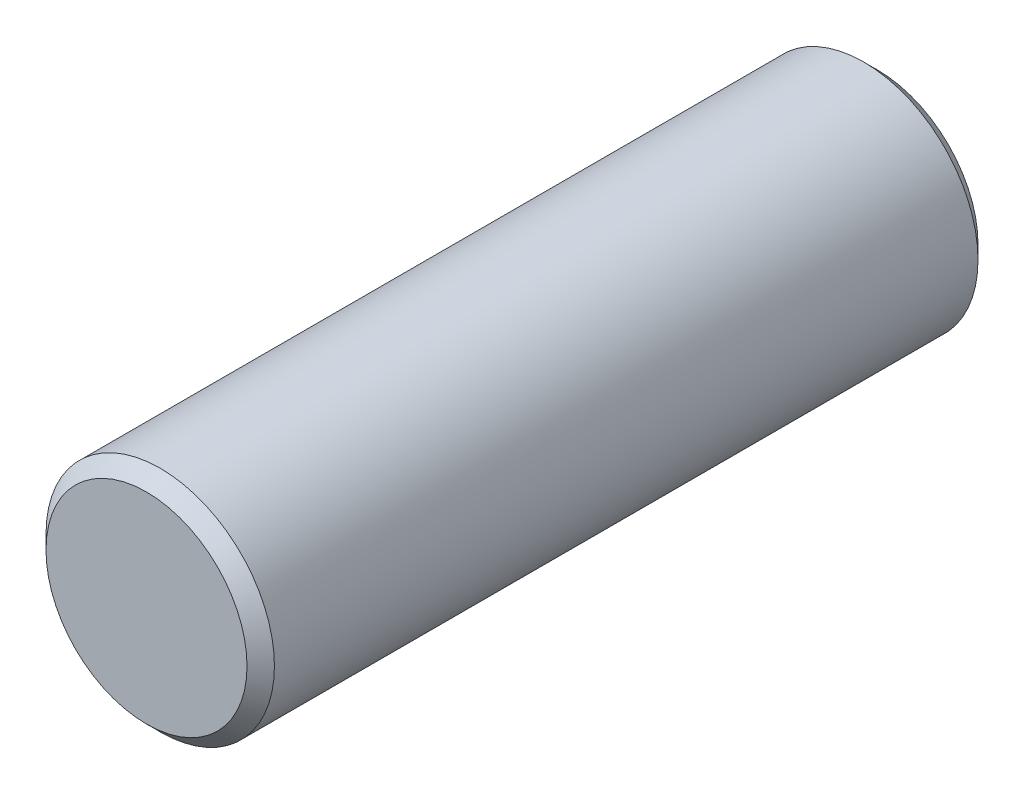
from build123d import *

# Parameters (mm, degrees)
SKETCH1_R           = 2.5
BOSS_EXTRUDE1_DEPTH = 16
CHAMFER1_SIZE       = 0.3


with BuildPart() as part:
    # Sketch1 → Boss-Extrude1 (new body)
    with BuildSketch(Plane.XY):
        Circle(SKETCH1_R)
    extrude(amount=-BOSS_EXTRUDE1_DEPTH)

    # Chamfer1
    chamfer1_edges = [part.edges().sort_by_distance(p)[0] for p in [
        (-2.5, 0, 0),
        (-2.5, 0, -16),
    ]]
    chamfer(chamfer1_edges, length=CHAMFER1_SIZE)


solid = part.part
